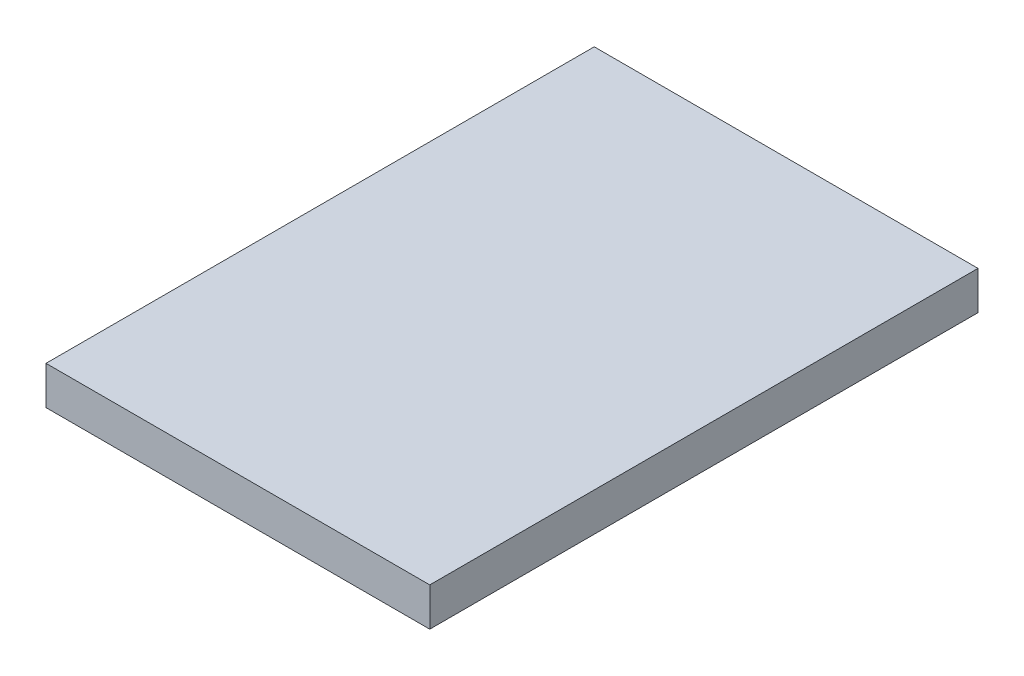
from build123d import *

# Parameters (mm, degrees)
SKETCH1_W           = 70
SKETCH1_H           = 100
BOSS_EXTRUDE1_DEPTH = 7


with BuildPart() as part:
    # Sketch1 → Boss-Extrude1 (new body)
    with BuildSketch(Plane(origin=(0, 0, 0), x_dir=(1, 0, 0), z_dir=(0, 1, 0))):
        Rectangle(SKETCH1_W, SKETCH1_H)
    extrude(amount=BOSS_EXTRUDE1_DEPTH)


solid = part.part
